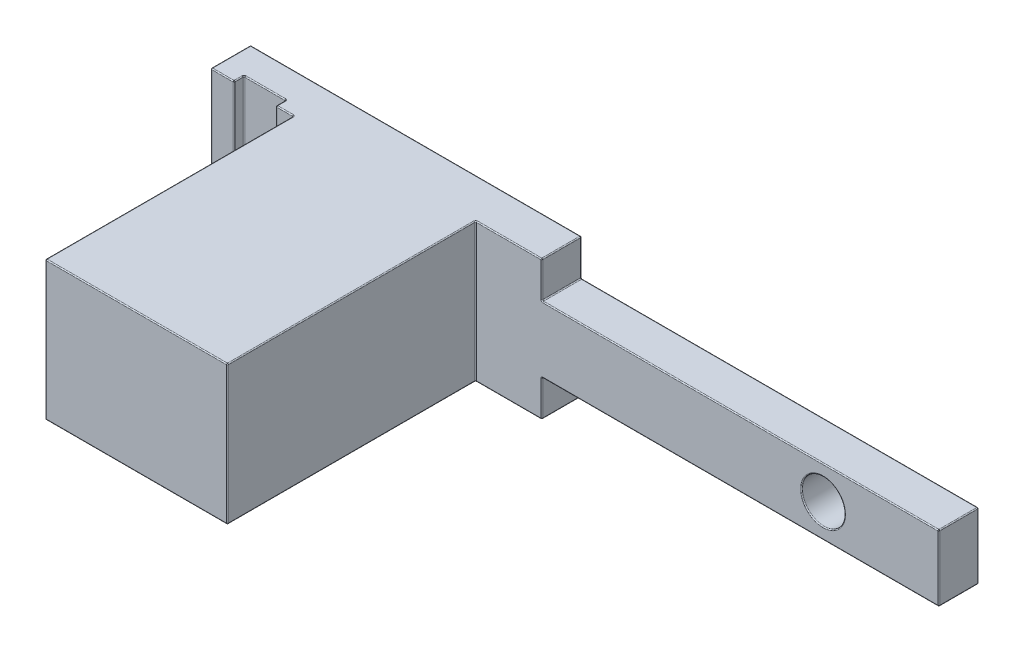
from build123d import *

# Parameters (mm, degrees)
SKETCH1_W           = 30.48
SKETCH1_H           = 5.08
SKETCH1_R           = 1.651
SKETCH1_W_2         = 25.4
SKETCH1_H_2         = 10.668
BOSS_EXTRUDE1_DEPTH = 3.048
SKETCH2_W           = 13.97
SKETCH2_H           = 10.668
BOSS_EXTRUDE2_DEPTH = 19.05
SKETCH3_W           = 3.218066788
SKETCH3_H           = 10.668
CUT_EXTRUDE1_DEPTH  = 0.762
FILLET1_R           = 0.075


with BuildPart() as part:
    # Sketch1 → Boss-Extrude1 (new body)
    # profile 1 of 2: a face of its own
    with BuildSketch(Plane.XY):
        with Locations((40.64, 5.334)):
            Rectangle(SKETCH1_W, SKETCH1_H)
        with Locations(Location((46.99, 5.334, 0), (0, 0, 180))):
            Circle(SKETCH1_R, mode=Mode.SUBTRACT)
    # profile 2 of 2: a face of its own
    with BuildSketch(Plane.XY):
        with Locations((12.7, 5.334)):
            Rectangle(SKETCH1_W_2, SKETCH1_H_2)
    extrude(amount=BOSS_EXTRUDE1_DEPTH)

    # Sketch2 → Boss-Extrude2 (add)
    with BuildSketch(Plane.XY.offset(3.048)):
        with Locations((13.335, 5.334)):
            Rectangle(SKETCH2_W, SKETCH2_H)
    extrude(amount=BOSS_EXTRUDE2_DEPTH)

    # Sketch3 → Cut-Extrude1 (cut)
    with BuildSketch(Plane.XY.offset(3.048)):
        with Locations((3.387033394, 5.334)):
            Rectangle(SKETCH3_W, SKETCH3_H)
    extrude(amount=-CUT_EXTRUDE1_DEPTH, mode=Mode.SUBTRACT)

    # Fillet1
    fillet1_edges = [part.edges().sort_by_distance(p)[0] for p in [
        (25.4, 1.397, 0),
        (12.7, 0, 0),
        (0, 5.334, 0),
        (12.7, 10.668, 0),
        (25.4, 9.271, 0),
        (40.64, 7.874, 3.048),
        (40.64, 7.874, 0),
        (55.88, 5.334, 0),
        (48.641, 5.334, 0),
        (25.4, 9.271, 3.048),
        (55.88, 2.794, 1.524),
        (25.4, 2.794, 1.524),
        (25.4, 0, 1.524),
        (0, 0, 1.524),
        (0, 10.668, 1.524),
        (25.4, 10.668, 1.524),
        (25.4, 7.874, 1.524),
        (55.88, 7.874, 1.524),
        (22.86, 10.668, 3.048),
        (0, 5.334, 3.048),
        (5.673033394, 10.668, 3.048),
        (5.673033394, 0, 3.048),
        (22.86, 0, 3.048),
        (6.35, 5.334, 3.048),
        (6.35, 10.668, 12.573),
        (6.35, 0, 12.573),
        (20.32, 5.334, 3.048),
        (20.32, 0, 12.573),
        (20.32, 10.668, 12.573),
        (6.35, 5.334, 22.098),
        (13.335, 0, 22.098),
        (20.32, 5.334, 22.098),
        (13.335, 10.668, 22.098),
        (25.4, 1.397, 3.048),
        (40.64, 2.794, 3.048),
        (0.889, 0, 3.048),
        (0.889, 10.668, 3.048),
        (1.778, 5.334, 2.286),
        (1.778, 0, 2.667),
        (3.387033394, 10.668, 2.286),
        (1.778, 10.668, 2.667),
        (4.996066788, 5.334, 2.286),
        (4.996066788, 10.668, 2.667),
        (3.387033394, 0, 2.286),
        (4.996066788, 0, 2.667),
        (1.778, 5.334, 3.048),
        (4.996066788, 5.334, 3.048),
        (48.641, 5.334, 3.048),
        (55.88, 5.334, 3.048),
        (40.64, 2.794, 0),
    ]]
    fillet(fillet1_edges, radius=FILLET1_R)


solid = part.part
